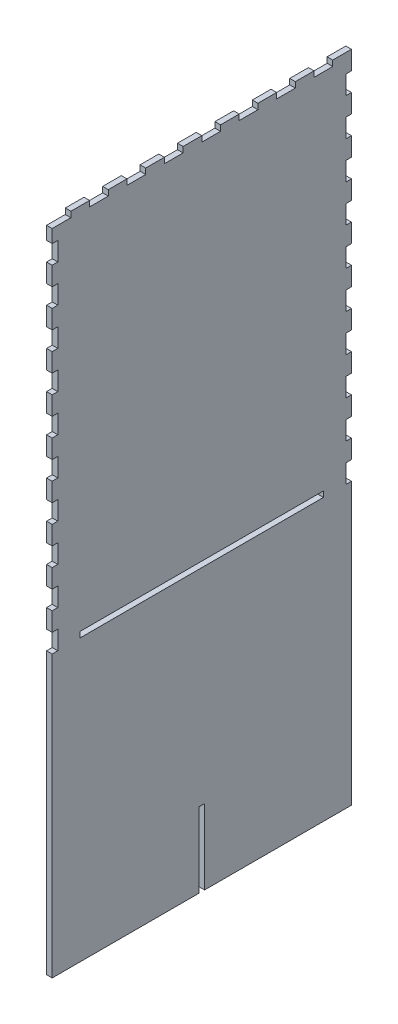
from build123d import *

# Parameters (mm, degrees)
CROQUIS1_W              = 130
CROQUIS1_H              = 3
SALIENTE_EXTRUIR1_DEPTH = 3


with BuildPart() as part:
    # Croquis1 → Saliente-Extruir1 (new body)
    with BuildSketch(Plane(origin=(0, 0, 0), x_dir=(0, 0, -1), z_dir=(1, 0, 0))):
        Polygon((-80.00000142, -80), (-80.00000142, -90), (-77.00000142, -90), (-77.000027229, -100), (-80, -100), (-80, -250), (-1.5, -250), (-1.5, -210), (1.5, -210), (1.5, -250), (80, -250), (80, -100), (77.000027229, -100), (77.00000142, -90), (80.00000142, -90), (80.00000142, -80), (77.000019468, -80), (77.000001401, -70.000000014), (80.000001401, -70.000000014), (80.000001401, -60.000000014), (77.000019449, -60.000000014), (77.000001383, -50.000000028), (80.000001383, -50.000000028), (80.000001383, -40.000000028), (77.000019431, -40.000000028), (77.000001365, -30.000000042), (80.000001365, -30.000000042), (80.000001365, -20.000000042), (77.000019412, -20.000000042), (77.000001346, -10.000000056), (80.000001346, -10.000000056), (80.000001346, -5.6e-08), (77.000019394, -5.6e-08), (77.000001328, 9.99999993), (80.000001328, 9.99999993), (80.000001328, 19.99999993), (77.000019376, 19.99999993), (77.00000131, 29.999999916), (80.00000131, 29.999999916), (80.00000131, 39.999999916), (77.000019357, 39.999999916), (77.000001291, 49.999999903), (80.000001291, 49.999999903), (80.000001291, 59.999999903), (77.000019339, 59.999999903), (77.000001273, 69.999999889), (80.000001273, 69.999999889), (80.000001273, 79.999999889), (77.000019321, 79.999999889), (77.000001254, 90), (80, 90), (80, 97), (80, 100), (70, 100), (70, 97), (60, 97), (60, 100), (50, 100), (50, 97), (40, 97), (40, 100), (30, 100), (30, 97), (20, 97), (20, 100), (10, 100), (10, 97), (0, 97), (0, 100), (-10, 100), (-10, 97), (-20, 97), (-20, 100), (-30, 100), (-30, 97), (-40, 97), (-40, 100), (-50, 100), (-50, 97), (-60, 97), (-60, 100), (-70, 100), (-70, 97), (-80, 97), (-80, 90), (-77.000001254, 90), (-77.000019321, 79.999999889), (-80.000001273, 79.999999889), (-80.000001273, 69.999999889), (-77.000001273, 69.999999889), (-77.000019339, 59.999999903), (-80.000001291, 59.999999903), (-80.000001291, 49.999999903), (-77.000001291, 49.999999903), (-77.000019357, 39.999999916), (-80.00000131, 39.999999916), (-80.00000131, 29.999999916), (-77.00000131, 29.999999916), (-77.000019376, 19.99999993), (-80.000001328, 19.99999993), (-80.000001328, 9.99999993), (-77.000001328, 9.99999993), (-77.000019394, -5.6e-08), (-80.000001346, -5.6e-08), (-80.000001346, -10.000000056), (-77.000001346, -10.000000056), (-77.000019412, -20.000000042), (-80.000001365, -20.000000042), (-80.000001365, -30.000000042), (-77.000001365, -30.000000042), (-77.000019431, -40.000000028), (-80.000001383, -40.000000028), (-80.000001383, -50.000000028), (-77.000001383, -50.000000028), (-77.000019449, -60.000000014), (-80.000001401, -60.000000014), (-80.000001401, -70.000000014), (-77.000001401, -70.000000014), (-77.000019468, -80), align=None)
        with Locations((0, -98.5)):
            Rectangle(CROQUIS1_W, CROQUIS1_H, mode=Mode.SUBTRACT)
    extrude(amount=SALIENTE_EXTRUIR1_DEPTH)


solid = part.part
